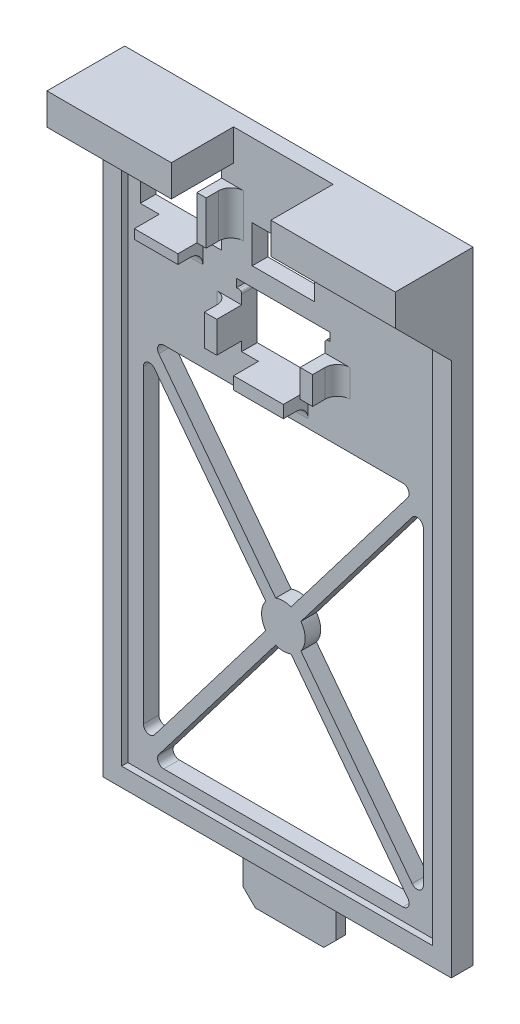
from build123d import *

# Parameters (mm, degrees)
SKETCH1_W            = 56
SKETCH1_H            = 100
BOSS_EXTRUDE1_DEPTH  = 2.5
SKETCH2_W            = 20
SKETCH2_H            = 5.05
BOSS_EXTRUDE2_DEPTH  = 10
SKETCH3_W            = 13.1
SKETCH3_H            = 13.1
CUT_EXTRUDE1_DEPTH   = 112.005866962
BOSS_EXTRUDE3_DEPTH  = 5
BOSS_EXTRUDE4_DEPTH  = 5
SKETCH6_W            = 7
SKETCH6_H            = 1.5
SKETCH6_W_2          = 1.5
SKETCH6_H_2          = 7
BOSS_EXTRUDE5_DEPTH  = 4
SKETCH7_W            = 15
SKETCH7_H            = 1.3
CUT_EXTRUDE2_DEPTH   = 112.005866962
SKETCH8_W            = 13.4
SKETCH8_H            = 8.5
SKETCH8_W_2          = 10
SKETCH8_H_2          = 6
CUT_EXTRUDE3_DEPTH   = 112.005866962
FILLET1_R            = 2
SKETCH9_W            = 15
SKETCH9_H            = 8
BOSS_EXTRUDE6_DEPTH  = 2.5
CHAMFER1_SIZE        = 2
SKETCH10_W           = 45
SKETCH10_H           = 59
CUT_EXTRUDE4_DEPTH   = 4
BOSS_EXTRUDE7_DEPTH  = 2.5
FILLET2_R            = 1
FILLET3_R            = 0.5
CUT_EXTRUDE5_DEPTH   = 1
SKETCH13_W           = 1
SKETCH13_H           = 88
BOSS_EXTRUDE8_DEPTH  = 3
BOSS_EXTRUDE9_DEPTH  = 3
SKETCH15_W           = 50
SKETCH15_H           = 3
BOSS_EXTRUDE10_DEPTH = 1
SKETCH16_W           = 2
SKETCH16_H           = 5
SKETCH16_W_2         = 8
SKETCH16_H_2         = 2
SKETCH16_H_3         = 4.4346707
BOSS_EXTRUDE11_DEPTH = 4
FILLET4_R            = 2


with BuildPart() as part:
    # Sketch1 → Boss-Extrude1 (new body)
    with BuildSketch(Plane.XY):
        with Locations((0, -56.95)):
            Rectangle(SKETCH1_W, SKETCH1_H)
    extrude(amount=BOSS_EXTRUDE1_DEPTH)

    # Sketch2 → Boss-Extrude2 (add)
    with BuildSketch(Plane.XY.offset(2.5)):
        with Locations((-18, -9.475)):
            Rectangle(SKETCH2_W, SKETCH2_H)
        with Locations((18, -9.475)):
            Rectangle(SKETCH2_W, SKETCH2_H)
    extrude(amount=BOSS_EXTRUDE2_DEPTH)

    # Sketch3 → Cut-Extrude1 (cut, through all)
    with BuildSketch(Plane.XY.offset(2.5)):
        with Locations((-16.45, -18.55)):
            Rectangle(SKETCH3_W, SKETCH3_H)
    extrude(amount=-CUT_EXTRUDE1_DEPTH, mode=Mode.SUBTRACT)

    # Sketch4 → Boss-Extrude3 (add)
    with BuildSketch(Plane(origin=(28, 0, 0), x_dir=(0, 0, -1), z_dir=(1, 0, 0))):
        Polygon((-12.5, -12), (-2.5, -12), (-2.5, -22), align=None)
    extrude(amount=-BOSS_EXTRUDE3_DEPTH)

    # Sketch5 → Boss-Extrude4 (add)
    with BuildSketch(Plane.ZY.offset(28)):
        Polygon((2.5, -22), (12.5, -12), (2.5, -12), align=None)
    extrude(amount=-BOSS_EXTRUDE4_DEPTH)

    # Sketch6 → Boss-Extrude5 (add)
    with BuildSketch(Plane.XY.offset(2.5)):
        with Locations((-16.45, -25.85)):
            Rectangle(SKETCH6_W, SKETCH6_H)
        with Locations((-9.15, -18.55)):
            Rectangle(SKETCH6_W_2, SKETCH6_H_2)
    extrude(amount=BOSS_EXTRUDE5_DEPTH)

    # Sketch7 → Cut-Extrude2 (cut, through all)
    with BuildSketch(Plane.XY.offset(2.5)):
        with Locations((0, -28.45)):
            Rectangle(SKETCH7_W, SKETCH7_H)
    extrude(amount=-CUT_EXTRUDE2_DEPTH, mode=Mode.SUBTRACT)

    # Sketch8 → Cut-Extrude3 (cut, through all)
    with BuildSketch(Plane.XY.offset(2.5)):
        with Locations((0, -33.35)):
            Rectangle(SKETCH8_W, SKETCH8_H)
        with Locations((0, -21.8)):
            Rectangle(SKETCH8_W_2, SKETCH8_H_2)
    extrude(amount=-CUT_EXTRUDE3_DEPTH, mode=Mode.SUBTRACT)

    # Fillet1
    fillet1_edges = [part.edges().sort_by_distance(p)[0] for p in [
        (-16.45, -26.6, 2.5),
        (-8.4, -18.55, 2.5),
    ]]
    fillet(fillet1_edges, radius=FILLET1_R)

    # Sketch9 → Boss-Extrude6 (add)
    with BuildSketch(Plane.XY.offset(2.5)):
        with Locations((0, -110.95)):
            Rectangle(SKETCH9_W, SKETCH9_H)
    extrude(amount=-BOSS_EXTRUDE6_DEPTH)

    # Chamfer1
    chamfer1_edges = [part.edges().sort_by_distance(p)[0] for p in [
        (-7.5, -114.95, 1.25),
        (7.5, -114.95, 1.25),
    ]]
    chamfer(chamfer1_edges, length=CHAMFER1_SIZE)

    # Sketch10 → Cut-Extrude4 (cut)
    with BuildSketch(Plane.XY.offset(2.5)):
        with Locations((0, -72.45)):
            Rectangle(SKETCH10_W, SKETCH10_H)
    extrude(amount=-CUT_EXTRUDE4_DEPTH, mode=Mode.SUBTRACT)

    # Sketch11 → Boss-Extrude7 (add)
    with BuildSketch(Plane.XY.offset(2.5)):
        with BuildLine():
            Line((-21.242331765, -42.95), (-22.5, -42.95))
            Line((-22.5, -42.95), (-22.5, -44.598942796))
            Line((-22.5, -44.598942796), (-2.829214626, -70.389528064))
            ThreePointArc((-2.829214626, -70.389528064), (-2.122572116, -69.667072115), (-1.238970121, -69.176629712))
            Line((-1.238970121, -69.176629712), (-21.242331765, -42.95))
        make_face()
        with BuildLine():
            Line((22.5, -42.95), (21.242331765, -42.95))
            Line((21.242331765, -42.95), (1.238970121, -69.176629712))
            ThreePointArc((1.238970121, -69.176629712), (2.122572116, -69.667072115), (2.829214626, -70.389528064))
            Line((2.829214626, -70.389528064), (22.5, -44.598942796))
            Line((22.5, -44.598942796), (22.5, -42.95))
        make_face()
        with BuildLine():
            Line((22.5, -100.301057204), (2.829214626, -74.510471936))
            ThreePointArc((2.829214626, -74.510471936), (2.122572116, -75.232927885), (1.238970121, -75.723370288))
            Line((1.238970121, -75.723370288), (21.242331765, -101.95))
            Line((21.242331765, -101.95), (22.5, -101.95))
            Line((22.5, -101.95), (22.5, -100.301057204))
        make_face()
        with BuildLine():
            Line((-2.829214626, -74.510471936), (-22.5, -100.301057204))
            Line((-22.5, -100.301057204), (-22.5, -101.95))
            Line((-22.5, -101.95), (-21.242331765, -101.95))
            Line((-21.242331765, -101.95), (-1.238970121, -75.723370288))
            ThreePointArc((-1.238970121, -75.723370288), (-2.122572116, -75.232927885), (-2.829214626, -74.510471936))
        make_face()
        with BuildLine():
            Line((-1.257668235, -72.45), (-2.829214626, -70.389528064))
            ThreePointArc((-2.829214626, -70.389528064), (-3.5, -72.45), (-2.829214626, -74.510471936))
            Line((-2.829214626, -74.510471936), (-1.257668235, -72.45))
        make_face()
        with BuildLine():
            Line((0, -70.801057204), (-1.238970121, -69.176629712))
            ThreePointArc((-1.238970121, -69.176629712), (-2.122572116, -69.667072115), (-2.829214626, -70.389528064))
            Line((-2.829214626, -70.389528064), (-1.257668235, -72.45))
            Line((-1.257668235, -72.45), (0, -70.801057204))
        make_face()
        with BuildLine():
            Line((0, -74.098942796), (-1.257668235, -72.45))
            Line((-1.257668235, -72.45), (-2.829214626, -74.510471936))
            ThreePointArc((-2.829214626, -74.510471936), (-2.122572116, -75.232927885), (-1.238970121, -75.723370288))
            Line((-1.238970121, -75.723370288), (0, -74.098942796))
        make_face()
        with BuildLine():
            Line((1.238970121, -75.723370288), (0, -74.098942796))
            Line((0, -74.098942796), (-1.238970121, -75.723370288))
            ThreePointArc((-1.238970121, -75.723370288), (0, -75.95), (1.238970121, -75.723370288))
        make_face()
        with BuildLine():
            Line((2.829214626, -70.389528064), (1.257668235, -72.45))
            Line((1.257668235, -72.45), (2.829214626, -74.510471936))
            ThreePointArc((2.829214626, -74.510471936), (3.328081369, -73.533454846), (3.5, -72.45))
            ThreePointArc((3.5, -72.45), (3.328081369, -71.366545154), (2.829214626, -70.389528064))
        make_face()
        with BuildLine():
            Line((2.829214626, -74.510471936), (1.257668235, -72.45))
            Line((1.257668235, -72.45), (0, -74.098942796))
            Line((0, -74.098942796), (1.238970121, -75.723370288))
            ThreePointArc((1.238970121, -75.723370288), (2.122572116, -75.232927885), (2.829214626, -74.510471936))
        make_face()
        with BuildLine():
            Line((1.238970121, -69.176629712), (0, -70.801057204))
            Line((0, -70.801057204), (1.257668235, -72.45))
            Line((1.257668235, -72.45), (2.829214626, -70.389528064))
            ThreePointArc((2.829214626, -70.389528064), (2.122572116, -69.667072115), (1.238970121, -69.176629712))
        make_face()
        with BuildLine():
            ThreePointArc((1.238970121, -69.176629712), (0, -68.95), (-1.238970121, -69.176629712))
            Line((-1.238970121, -69.176629712), (0, -70.801057204))
            Line((0, -70.801057204), (1.238970121, -69.176629712))
        make_face()
        Polygon((1.257668235, -72.45), (0, -70.801057204), (-1.257668235, -72.45), (0, -74.098942796), align=None)
    extrude(amount=-BOSS_EXTRUDE7_DEPTH)

    # Fillet2
    fillet2_edges = [part.edges().sort_by_distance(p)[0] for p in [
        (-22.5, -100.301057204, 1.25),
        (-21.242331765, -101.95, 1.25),
        (21.242331765, -101.95, 1.25),
        (22.5, -100.301057204, 1.25),
        (22.5, -44.598942796, 1.25),
        (21.242331765, -42.95, 1.25),
        (-21.242331765, -42.95, 1.25),
        (-22.5, -44.598942796, 1.25),
    ]]
    fillet(fillet2_edges, radius=FILLET2_R)

    # Fillet3
    fillet3_edges = [part.edges().sort_by_distance(p)[0] for p in [
        (6.7, -29.1, 1.25),
        (-6.7, -29.1, 1.25),
    ]]
    fillet(fillet3_edges, radius=FILLET3_R)

    # Sketch12 → Cut-Extrude5 (cut)
    with BuildSketch(Plane.XY.offset(2.5)):
        Polygon((-7.5, -106.95), (7.5, -106.95), (7.5, -112.95), (5.5, -114.95), (-5.5, -114.95), (-7.5, -112.95), align=None)
    extrude(amount=-CUT_EXTRUDE5_DEPTH, mode=Mode.SUBTRACT)

    # Sketch13 → Boss-Extrude8 (add)
    with BuildSketch(Plane(origin=(28, 0, 0), x_dir=(0, 0, -1), z_dir=(1, 0, 0))):
        with Locations((-3, -62.95)):
            Rectangle(SKETCH13_W, SKETCH13_H)
    extrude(amount=-BOSS_EXTRUDE8_DEPTH)

    # Sketch14 → Boss-Extrude9 (add)
    with BuildSketch(Plane.ZY.offset(28)):
        Polygon((3.5, -21), (3.5, -106.95), (2.5, -106.95), (2.5, -22), align=None)
    extrude(amount=-BOSS_EXTRUDE9_DEPTH)

    # Sketch15 → Boss-Extrude10 (add)
    with BuildSketch(Plane.XY.offset(2.5)):
        with Locations((0, -105.45)):
            Rectangle(SKETCH15_W, SKETCH15_H)
    extrude(amount=BOSS_EXTRUDE10_DEPTH)

    # Sketch16 → Boss-Extrude11 (add)
    with BuildSketch(Plane.XY.offset(2.5)):
        with Locations((-7.7, -33.6)):
            Rectangle(SKETCH16_W, SKETCH16_H)
        with Locations((0, -38.6)):
            Rectangle(SKETCH16_W_2, SKETCH16_H_2)
        with Locations((7.7, -33.31733535)):
            Rectangle(SKETCH16_W, SKETCH16_H_3)
    extrude(amount=BOSS_EXTRUDE11_DEPTH)

    # Fillet4
    fillet4_edges = [part.edges().sort_by_distance(p)[0] for p in [
        (-8.7, -33.6, 2.5),
        (0, -39.6, 2.5),
        (8.7, -33.31733535, 2.5),
    ]]
    fillet(fillet4_edges, radius=FILLET4_R)


solid = part.part
